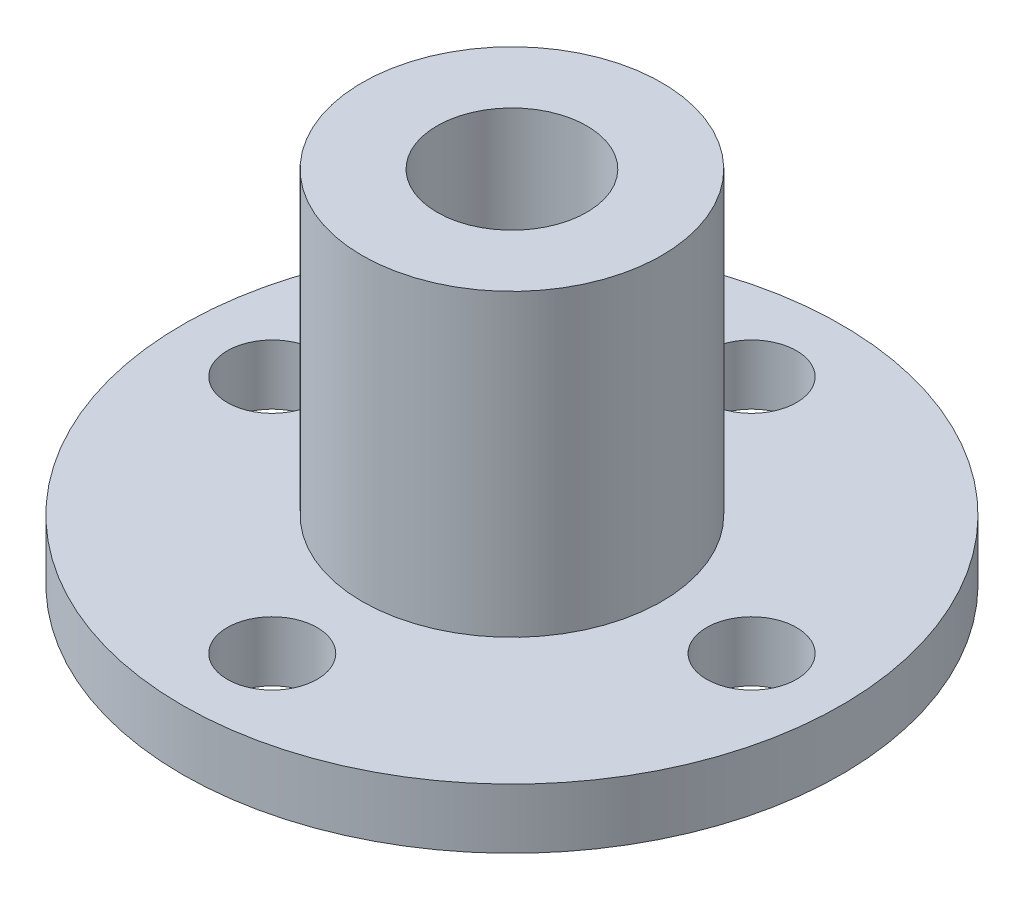
from build123d import *

# Parameters (mm, degrees)
SKETCH1_R           = 11
SKETCH1_R_2         = 1.5
SKETCH1_R_3         = 2.5
BOSS_EXTRUDE1_DEPTH = 2
SKETCH2_R           = 5
SKETCH2_R_2         = 2.5
BOSS_EXTRUDE2_DEPTH = 10


with BuildPart() as part:
    # Sketch1 → Boss-Extrude1 (new body)
    with BuildSketch(Plane(origin=(0, 0, 0), x_dir=(1, 0, 0), z_dir=(0, 1, 0))):
        with Locations(Location((0, 0, 0), (0, 0, 270))):
            Circle(SKETCH1_R)
        with Locations(Location((0, 8, 0), (0, 0, 270))):
            Circle(SKETCH1_R_2, mode=Mode.SUBTRACT)
        with Locations(Location((8, 0, 0), (0, 0, 270))):
            Circle(SKETCH1_R_2, mode=Mode.SUBTRACT)
        with Locations(Location((0, -8, 0), (0, 0, 270))):
            Circle(SKETCH1_R_2, mode=Mode.SUBTRACT)
        with Locations(Location((-8, 0, 0), (0, 0, 270))):
            Circle(SKETCH1_R_2, mode=Mode.SUBTRACT)
        with Locations(Location((0, 0, 0), (0, 0, 270))):
            Circle(SKETCH1_R_3, mode=Mode.SUBTRACT)
    extrude(amount=BOSS_EXTRUDE1_DEPTH)

    # Sketch2 → Boss-Extrude2 (add)
    with BuildSketch(Plane(origin=(0, 2, 0), x_dir=(1, 0, 0), z_dir=(0, 1, 0))):
        with Locations(Location((0, 0, 0), (0, 0, 270))):
            Circle(SKETCH2_R)
        with Locations(Location((0, 0, 0), (0, 0, 270))):
            Circle(SKETCH2_R_2, mode=Mode.SUBTRACT)
    extrude(amount=BOSS_EXTRUDE2_DEPTH)


solid = part.part
